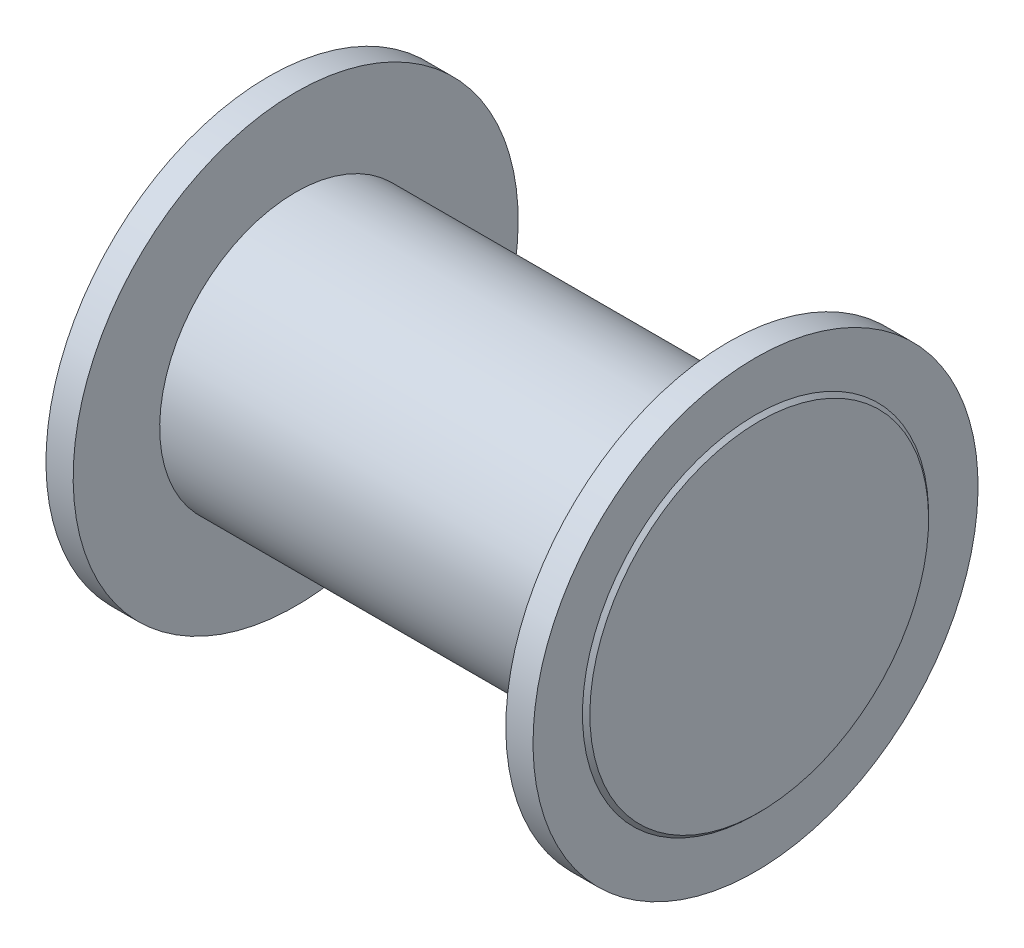
from build123d import *


with BuildPart() as part:
    # Sketch1 → Revolve1 (revolve)
    with BuildSketch(Plane.XY):
        Polygon((200, 0), (-200, 0), (-200, 137), (-197, 140), (-197, 180), (-175, 180), (-175, 110), (175, 110), (175, 180), (197, 180), (197, 140), (200, 137), align=None)
    revolve(axis=Axis((200, 0, 0), (-1, 0, 0)))


solid = part.part
